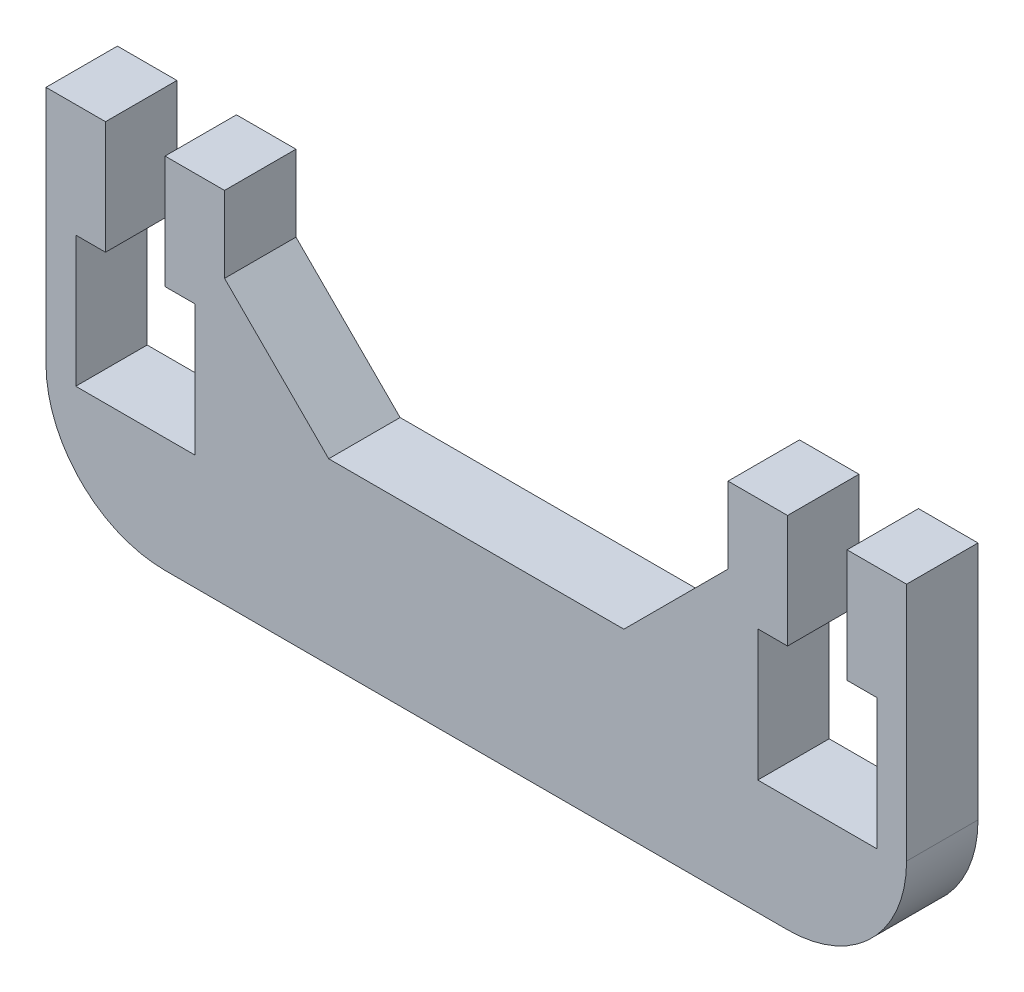
from build123d import *

# Parameters (mm, degrees)
BOSS_EXTRUDE1_DEPTH = 6
FILLET1_R           = 10
SKETCH2_W           = 5
SKETCH2_H           = 9.5
SKETCH2_W_2         = 10
SKETCH2_H_2         = 11
CUT_EXTRUDE1_DEPTH  = 60.571910327
CHAMFER1_SIZE       = 8.75


with BuildPart() as part:
    # Sketch1 → Boss-Extrude1 (new body)
    with BuildSketch(Plane.XY):
        Polygon((0, 0), (42.3, 0), (42.3, 15.15), (57.3, 15.15), (57.3, -15), (-15, -15), (-15, 15.15), (0, 15.15), align=None)
    extrude(amount=BOSS_EXTRUDE1_DEPTH)

    # Fillet1
    fillet1_edges = [part.edges().sort_by_distance(p)[0] for p in [
        (57.3, -15, 3),
        (-15, -15, 3),
    ]]
    fillet(fillet1_edges, radius=FILLET1_R)

    # Sketch2 → Cut-Extrude1 (cut, through all)
    with BuildSketch(Plane(origin=(0, 0, 0), x_dir=(-1, 0, 0), z_dir=(0, 0, -1))):
        with Locations((-49.8, 10.4)):
            Rectangle(SKETCH2_W, SKETCH2_H)
        with Locations((-49.8, 0.15)):
            Rectangle(SKETCH2_W_2, SKETCH2_H_2)
    cut_extrude1 = extrude(amount=-CUT_EXTRUDE1_DEPTH, mode=Mode.SUBTRACT)

    # Mirror1: Cut-Extrude1 across plane
    add(cut_extrude1.mirror(Plane(origin=(21.15, 0, 0), x_dir=(0, 0, 1), z_dir=(1, 0, 0))), mode=Mode.SUBTRACT)

    # Chamfer1
    chamfer1_edges = [part.edges().sort_by_distance(p)[0] for p in [
        (0, 0, 3),
        (42.3, 0, 3),
    ]]
    chamfer(chamfer1_edges, length=CHAMFER1_SIZE)


solid = part.part
